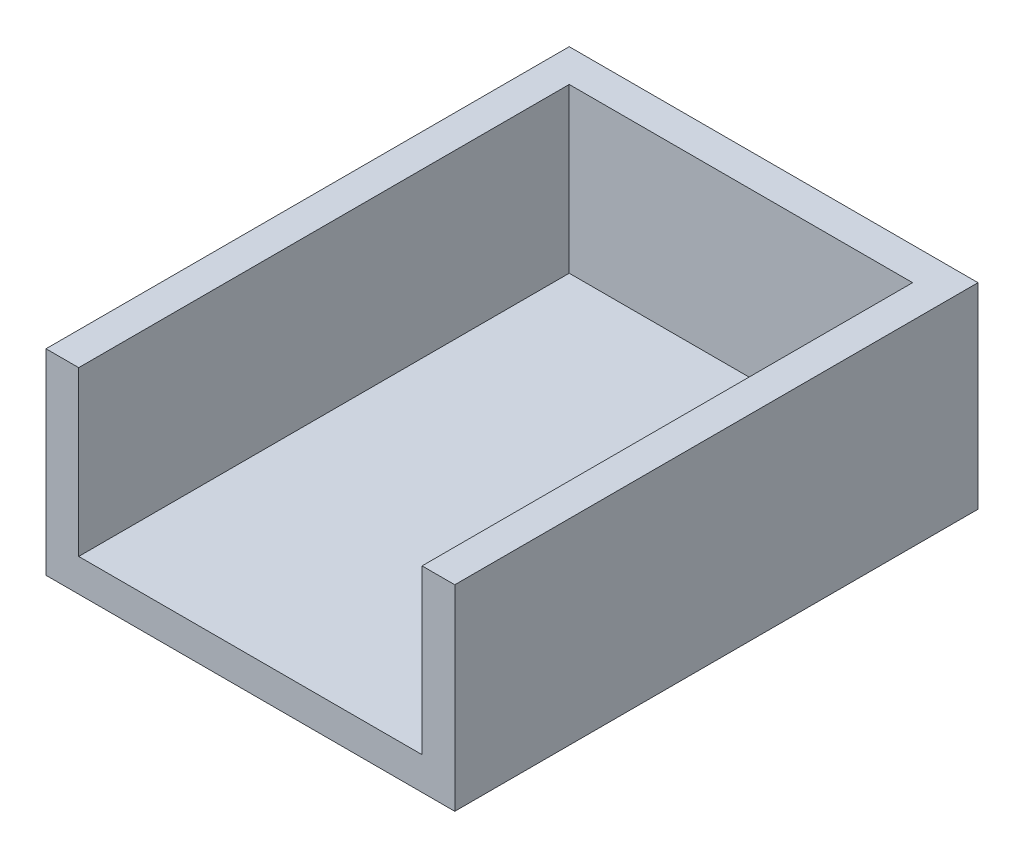
from build123d import *

# Parameters (mm, degrees)
SKETCH1_W           = 125
SKETCH1_H           = 160
BOSS_EXTRUDE1_DEPTH = 60
SHELL1_T            = -10
CUT_EXTRUDE1_DEPTH  = 7


with BuildPart() as part:
    # Sketch1 → Boss-Extrude1 (new body)
    with BuildSketch(Plane(origin=(0, 0, 0), x_dir=(1, 0, 0), z_dir=(0, 1, 0))):
        Rectangle(SKETCH1_W, SKETCH1_H)
    extrude(amount=BOSS_EXTRUDE1_DEPTH)

    # Shell1
    shell1_openings = [part.faces().sort_by_distance(p)[0] for p in [
        (0, 60, 0),
        (0, 30, 80),
    ]]
    offset(amount=SHELL1_T, openings=shell1_openings, kind=Kind.INTERSECTION)

    # Sketch2 → Cut-Extrude1 (cut)
    with BuildSketch(Plane(origin=(0, 0, -80), x_dir=(-1, 0, 0), z_dir=(0, 0, -1))):
        with BuildLine():
            Line((58.149914344, 28.0000547), (-53.250098626, 28.0000547))
            ThreePointArc((-53.250098626, 28.0000547), (-59.250098626, 22.0000547), (-53.250098626, 16.0000547))
            Line((-53.250098626, 16.0000547), (58.149914344, 16.000100476))
            ThreePointArc((58.149914344, 16.000100476), (64.149891456, 22.000077588), (58.149914344, 28.0000547))
        make_face()
    extrude(amount=-CUT_EXTRUDE1_DEPTH, mode=Mode.SUBTRACT)


solid = part.part
